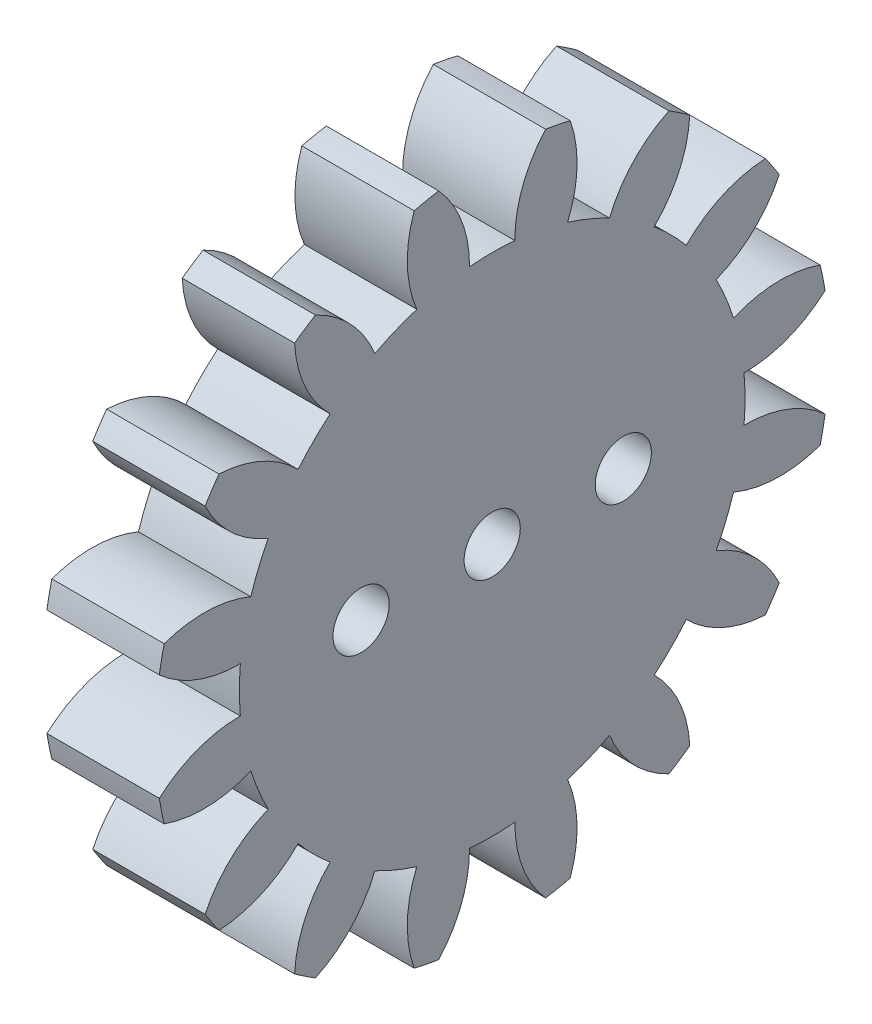
from build123d import *

# Parameters (mm, degrees)
BASPROSKE_W             = 6
BASPROSKE_H             = 18
TOOTHCUT_DEPTH          = 27.153393661
TEETHCUTS_COUNT         = 16
TEETHCUTS_ANGLE         = 337.5
BORSKE_R                = 4
BORE_DEPTH              = 50.0000508
CROQUIS1_R              = 4
CROQUIS1_R_2            = 1.5
SALIENTE_EXTRUIR1_DEPTH = 6
CROQUIS2_R              = 1.5
CORTAR_EXTRUIR1_DEPTH   = 6


with BuildPart() as part:
    # BasProSke → Base-Revolve (revolve)
    with BuildSketch(Plane(origin=(0, 0, 0), x_dir=(1, 0, 0), z_dir=(0, 1, 0)), mode=Mode.PRIVATE) as base_revolve_sk:
        with Locations((3, 9)):
            Rectangle(BASPROSKE_W, BASPROSKE_H)
    revolve(base_revolve_sk.sketch.rotate(Axis((-10, 0, 0), (1, 0, 0)), 180), axis=Axis((-10, 0, 0), (1, 0, 0)))

    # TooCutSke → ToothCut (cut, through all)
    with BuildSketch(Plane(origin=(0, 0, 0), x_dir=(0, 0, -1), z_dir=(1, 0, 0))):
        with BuildLine():
            ThreePointArc((1.210794474, 13.444589162), (0, 13.499), (-1.210794474, 13.444589162))
            ThreePointArc((-1.210794474, 13.444589162), (-1.632237109, 15.776340848), (-2.873179402, 17.794939879))
            ThreePointArc((-2.873179402, 17.794939879), (0, 18.0254), (2.873179402, 17.794939879))
            ThreePointArc((2.873179402, 17.794939879), (1.632237109, 15.776340848), (1.210794474, 13.444589162))
        make_face()
    toothcut = extrude(amount=TOOTHCUT_DEPTH, mode=Mode.SUBTRACT)

    # TeethCuts: ToothCut ×16 about axis
    teethcuts_axis = Axis((-10, 0, 0), (1, 0, 0))
    for i in range(1, TEETHCUTS_COUNT):
        add(toothcut.rotate(teethcuts_axis, i * TEETHCUTS_ANGLE / (TEETHCUTS_COUNT - 1)), mode=Mode.SUBTRACT)

    # BorSke → Bore (cut, symmetric)
    with BuildSketch(Plane(origin=(0, 0, 0), x_dir=(0, 0, -1), z_dir=(1, 0, 0))):
        with Locations(Location((0, 0, 0), (0, 0, 180))):
            Circle(BORSKE_R)
    extrude(amount=BORE_DEPTH, both=True, mode=Mode.SUBTRACT)

    # Croquis1 → Saliente-Extruir1 (add)
    with BuildSketch(Plane(origin=(6, 0, 0), x_dir=(0, 0, -1), z_dir=(1, 0, 0))):
        Circle(CROQUIS1_R)
        Circle(CROQUIS1_R_2, mode=Mode.SUBTRACT)
    extrude(amount=-SALIENTE_EXTRUIR1_DEPTH)

    # Croquis2 → Cortar-Extruir1 (cut)
    with BuildSketch(Plane(origin=(6, 0, 0), x_dir=(0, 0, -1), z_dir=(1, 0, 0))):
        with Locations((-7, 0)):
            Circle(CROQUIS2_R)
        with Locations((7, 0)):
            Circle(CROQUIS2_R)
    extrude(amount=-CORTAR_EXTRUIR1_DEPTH, mode=Mode.SUBTRACT)


solid = part.part
